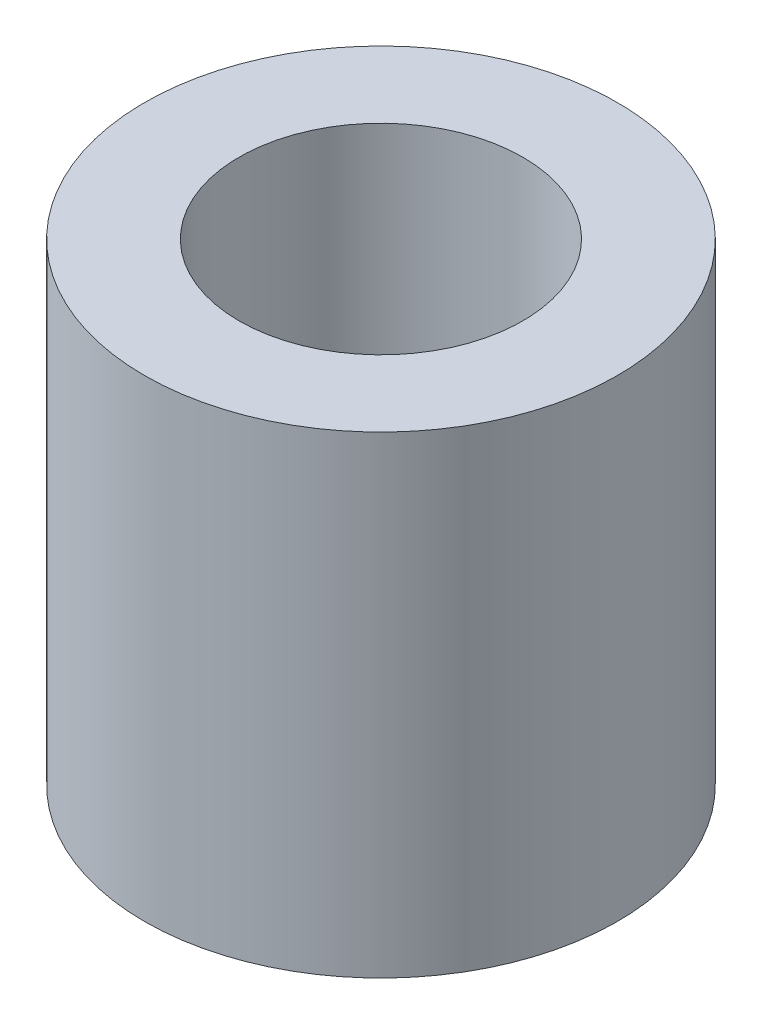
from build123d import *

# Parameters (mm, degrees)
ESQUISSE1_R        = 2.5
ESQUISSE1_R_2      = 1.5
BOSS_EXTRU_1_DEPTH = 5


with BuildPart() as part:
    # Esquisse1 → Boss.-Extru.1 (new body)
    with BuildSketch(Plane(origin=(0, 0, 0), x_dir=(1, 0, 0), z_dir=(0, 1, 0))):
        with Locations(Location((0, 0, 0), (0, 0, 270))):
            Circle(ESQUISSE1_R)
        with Locations(Location((0, 0, 0), (0, 0, 270))):
            Circle(ESQUISSE1_R_2, mode=Mode.SUBTRACT)
    extrude(amount=BOSS_EXTRU_1_DEPTH)


solid = part.part
